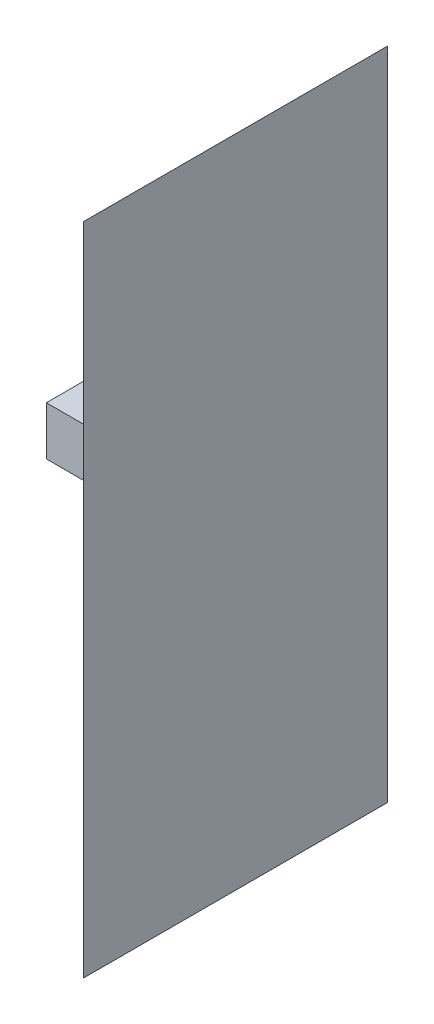
from build123d import *

# Parameters (mm, degrees)
SKETCH1_W               = 14.097
SKETCH1_H               = 14.097
BOSS_EXTRUDE1_DEPTH     = 12.446
SKETCH2_R               = 5.08
BOSS_EXTRUDE2_DEPTH     = 9.8806
CUT_EXTRUDE1_DEPTH      = 25.450762198
CUT_EXTRUDE1_DEPTH_BACK = 25.450762198
SKETCH3_R               = 1
SKETCH4_W               = 10.3378
SKETCH4_H               = 3.429
BOSS_EXTRUDE3_DEPTH     = 3.429


with BuildPart() as part:
    # Sketch1 → Boss-Extrude1 (new body)
    with BuildSketch(Plane.YZ):
        Rectangle(SKETCH1_W, SKETCH1_H)
    extrude(amount=BOSS_EXTRUDE1_DEPTH)

    # Sketch2 → Boss-Extrude2 (add)
    with BuildSketch(Plane.YZ.offset(12.446)):
        with Locations(Location((0, 0, 0), (0, 0, 270))):
            Circle(SKETCH2_R)
    extrude(amount=BOSS_EXTRUDE2_DEPTH)

    # Sketch3 → Cut-Extrude1 (cut, two sides: drawn at the far end of the back side and taken through both)
    with BuildSketch(Plane(origin=(0, 0, 0), x_dir=(-1, 0, 0), z_dir=(0, 1, 0)).offset(-CUT_EXTRUDE1_DEPTH_BACK)):
        with Locations(Location((-8.255, 0, 0), (0, 0, 90))):
            Circle(SKETCH3_R)
    extrude(amount=CUT_EXTRUDE1_DEPTH + CUT_EXTRUDE1_DEPTH_BACK, mode=Mode.SUBTRACT)

    # Sketch4 → Boss-Extrude3 (add)
    with BuildSketch(Plane(origin=(0, 0, 0), x_dir=(0, -1, 0), z_dir=(-1, 0, 0))):
        with Locations((1.8796, -2.794)):
            Rectangle(SKETCH4_W, SKETCH4_H)
    extrude(amount=BOSS_EXTRUDE3_DEPTH)


with BuildPart() as body_2:
    # Sketch8 → FOV section 0
    with BuildSketch(Plane(origin=(47.7266, 0, 0), x_dir=(0, 0, -1), z_dir=(1, 0, 0)), mode=Mode.PRIVATE) as fov_s0:
        with BuildLine():
            Line((43.994090512, -94.794090512), (-43.994090512, -94.794090512))
            Line((-43.994090512, -94.794090512), (-43.994090512, 94.794090512))
            Line((-43.994090512, 94.794090512), (43.994090512, 94.794090512))
            Line((43.994090512, 94.794090512), (43.994090512, -94.794090512))
        make_face()
    loft([fov_s0.sketch, Vertex(22.3266, 0, 0)])


solid = Compound([part.part, body_2.part])
